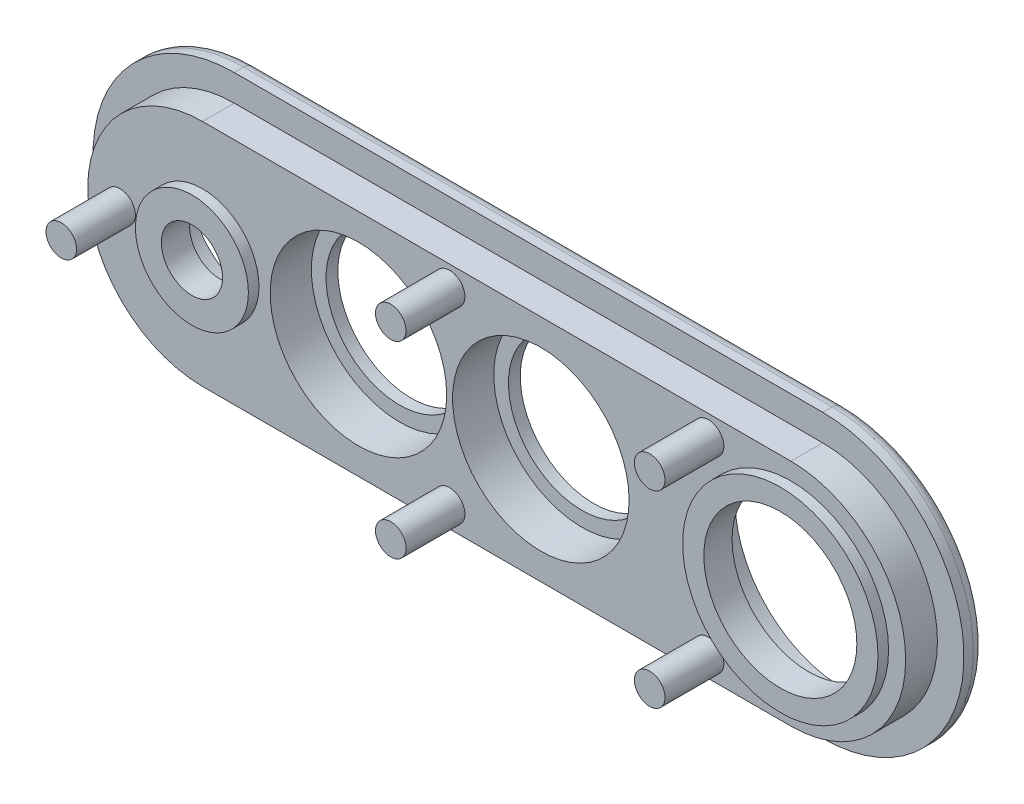
from build123d import *

# Parameters (mm, degrees)
EXTRUDE_1_DEPTH     = 4.5
CUT_EXTRUDE_1_DEPTH = 2.7
SKETCH_3_R          = 2.6
SKETCH_3_R_2        = 6.5
SKETCH_3_R_3        = 6.25
CUT_EXTRUDE_2_DEPTH = 67.635200908
SKETCH_4_R          = 5.5
SKETCH_4_R_2        = 9.25
CUT_EXTRUDE_3_DEPTH = 3
FILLET_1_R          = 1
SKETCH_7_R          = 7.5
CUT_EXTRUDE_6_DEPTH = 3.5
SKETCH_9_R          = 1.3
EXTRUDE_2_DEPTH     = 5
EXTRUDE_START       = 0.9
SKETCH_10_R         = 4.8
SKETCH_10_R_2       = 2.6
SKETCH_10_R_3       = 8.3
SKETCH_10_R_4       = 6.5
EXTRUDE_3_DEPTH     = 0.9


with BuildPart() as part:
    # Эскиз1 → Бобышка-Вытянуть1 (new body)
    with BuildSketch(Plane.XY):
        with BuildLine():
            Line((0, 0), (50, 0))
            ThreePointArc((50, 0), (62, -12), (50, -24))
            Line((50, -24), (0, -24))
            ThreePointArc((0, -24), (-12, -12), (0, 0))
        make_face()
    extrude(amount=EXTRUDE_1_DEPTH)

    # Эскиз2 → Вырез-Вытянуть1 (cut)
    with BuildSketch(Plane.XY.offset(4.5)):
        with BuildLine():
            Line((0, 0.012347922), (50, 0.012347922))
            ThreePointArc((50, 0.012347922), (62.012347922, -12), (50, -24.012347922))
            Line((50, -24.012347922), (0, -24.012347922))
            ThreePointArc((0, -24.012347922), (-12.012347922, -12), (0, 0.012347922))
        make_face()
        with BuildLine():
            Line((0, -2.25), (50, -2.25))
            ThreePointArc((50, -2.25), (59.75, -12), (50, -21.75))
            Line((50, -21.75), (0, -21.75))
            ThreePointArc((0, -21.75), (-9.75, -12), (0, -2.25))
        make_face(mode=Mode.SUBTRACT)
    extrude(amount=-CUT_EXTRUDE_1_DEPTH, mode=Mode.SUBTRACT)

    # Эскиз3 → Вырез-Вытянуть2 (cut, through all)
    with BuildSketch(Plane.XY.offset(4.5)):
        with Locations((0, -12)):
            Circle(SKETCH_3_R)
        with Locations((50, -12)):
            Circle(SKETCH_3_R_2)
        with Locations((13.25, -12)):
            Circle(SKETCH_3_R_3)
        with Locations((28.75, -12)):
            Circle(SKETCH_3_R_3)
    extrude(amount=-CUT_EXTRUDE_2_DEPTH, mode=Mode.SUBTRACT)

    # Эскиз4 → Вырез-Вытянуть3 (cut)
    with BuildSketch(Plane(origin=(0, 0, 0), x_dir=(-1, 0, 0), z_dir=(0, 0, -1))):
        with Locations((0, -12)):
            Circle(SKETCH_4_R)
        with Locations((-50, -12)):
            Circle(SKETCH_4_R_2)
    extrude(amount=-CUT_EXTRUDE_3_DEPTH, mode=Mode.SUBTRACT)

    # Скругление1
    fillet_1_edges = [part.edges().sort_by_distance(p)[0] for p in [
        (25, 0, 0),
        (62, -12, 0),
        (25, -24, 0),
        (-12, -12, 0),
    ]]
    fillet(fillet_1_edges, radius=FILLET_1_R)

    # Эскиз7 → Вырез-Вытянуть6 (cut)
    with BuildSketch(Plane.XY.offset(4.5)):
        with Locations((28.75, -12)):
            Circle(SKETCH_7_R)
        with Locations((13.25, -12)):
            Circle(SKETCH_7_R)
    extrude(amount=-CUT_EXTRUDE_6_DEPTH, mode=Mode.SUBTRACT)

    # Эскиз9 → Бобышка-Вытянуть2 (add)
    with BuildSketch(Plane.XY.offset(4.5)):
        with Locations((21, -4)):
            Circle(SKETCH_9_R)
        with Locations((21, -20)):
            Circle(SKETCH_9_R)
        with Locations((-7, -12)):
            Circle(SKETCH_9_R)
        with Locations((43, -4)):
            Circle(SKETCH_9_R)
        with Locations((43, -20)):
            Circle(SKETCH_9_R)
    extrude(amount=EXTRUDE_2_DEPTH)

    # Эскиз10 → Бобышка-Вытянуть3 (add)
    # profile 1 of 2: a face of its own
    with BuildSketch(Plane.XY.offset(4.5).offset(EXTRUDE_START)):
        with Locations((0, -12)):
            Circle(SKETCH_10_R)
        with Locations((0, -12)):
            Circle(SKETCH_10_R_2, mode=Mode.SUBTRACT)
    # profile 2 of 2: a face of its own
    with BuildSketch(Plane.XY.offset(4.5).offset(EXTRUDE_START)):
        with Locations((50, -12)):
            Circle(SKETCH_10_R_3)
        with Locations((50, -12)):
            Circle(SKETCH_10_R_4, mode=Mode.SUBTRACT)
    extrude(amount=-EXTRUDE_3_DEPTH)


solid = part.part
